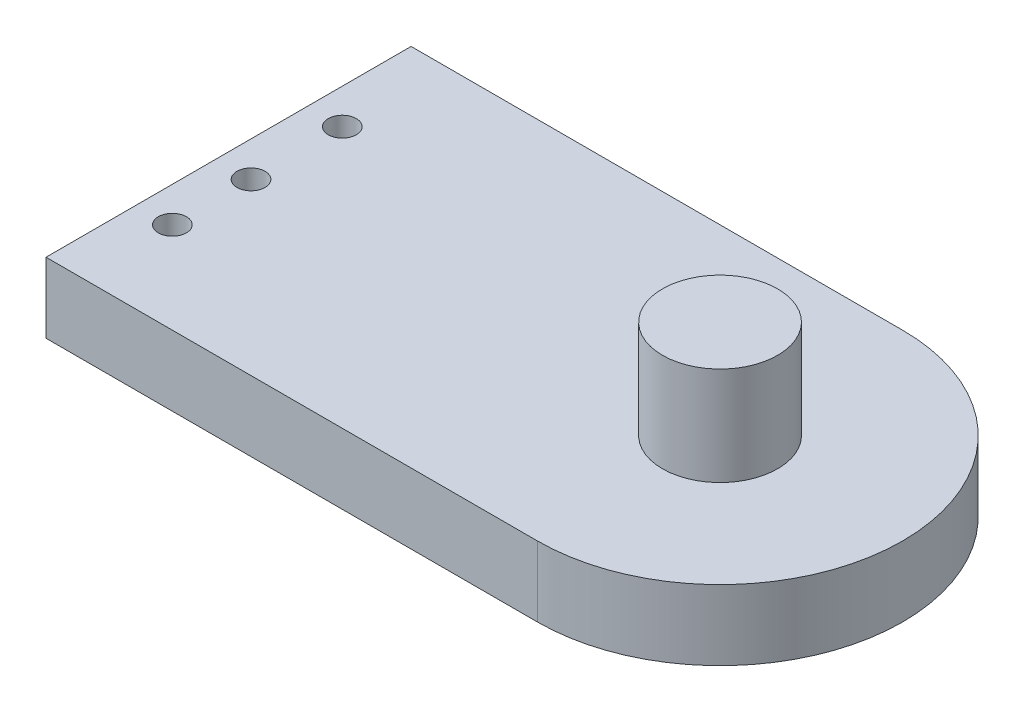
from build123d import *

# Parameters (mm, degrees)
BOSS_EXTRUDE1_DEPTH       = 5
SKETCH2_R                 = 4.1
BOSS_EXTRUDE2_DEPTH       = 7
F_2_0MM_DOWEL_HOLE2_D     = 2
F_2_0MM_DOWEL_HOLE2_DEPTH = 7
F_2_0MM_DOWEL_HOLE2_TIP   = 0.600860619


with BuildPart() as part:
    # Sketch1 → Boss-Extrude1 (new body)
    with BuildSketch(Plane(origin=(0, 0, 0), x_dir=(1, 0, 0), z_dir=(0, 1, 0))):
        with BuildLine():
            Line((0, 26), (0, 0))
            Line((0, 0), (35, 0))
            ThreePointArc((35, 0), (22, 13), (35, 26))
            Line((35, 26), (0, 26))
        make_face()
        with BuildLine():
            ThreePointArc((35, 26), (22, 13), (35, 0))
            Line((35, 0), (35, 26))
        make_face()
        with BuildLine():
            Line((35, 26), (35, 0))
            ThreePointArc((35, 0), (44.192388155, 3.807611845), (48, 13))
            ThreePointArc((48, 13), (44.192388155, 22.192388155), (35, 26))
        make_face()
    extrude(amount=BOSS_EXTRUDE1_DEPTH)

    # Sketch2 → Boss-Extrude2 (add)
    with BuildSketch(Plane(origin=(0, 5, 0), x_dir=(1, 0, 0), z_dir=(0, 1, 0))):
        with Locations(Location((35, 13, 0), (0, 0, 270))):
            Circle(SKETCH2_R)
    extrude(amount=BOSS_EXTRUDE2_DEPTH)

    # Ø2.0mm Dowel Hole2
    with Locations(Plane.XZ):
        with Locations((2.5, -6.5), (2.5, -12.1), (2.5, -18.6)):
            Hole(F_2_0MM_DOWEL_HOLE2_D / 2, depth=F_2_0MM_DOWEL_HOLE2_DEPTH)
            with Locations((0, 0, -(F_2_0MM_DOWEL_HOLE2_DEPTH + F_2_0MM_DOWEL_HOLE2_TIP / 2))):  # 118° drill point
                Cone(0, F_2_0MM_DOWEL_HOLE2_D / 2, F_2_0MM_DOWEL_HOLE2_TIP, mode=Mode.SUBTRACT)


solid = part.part
